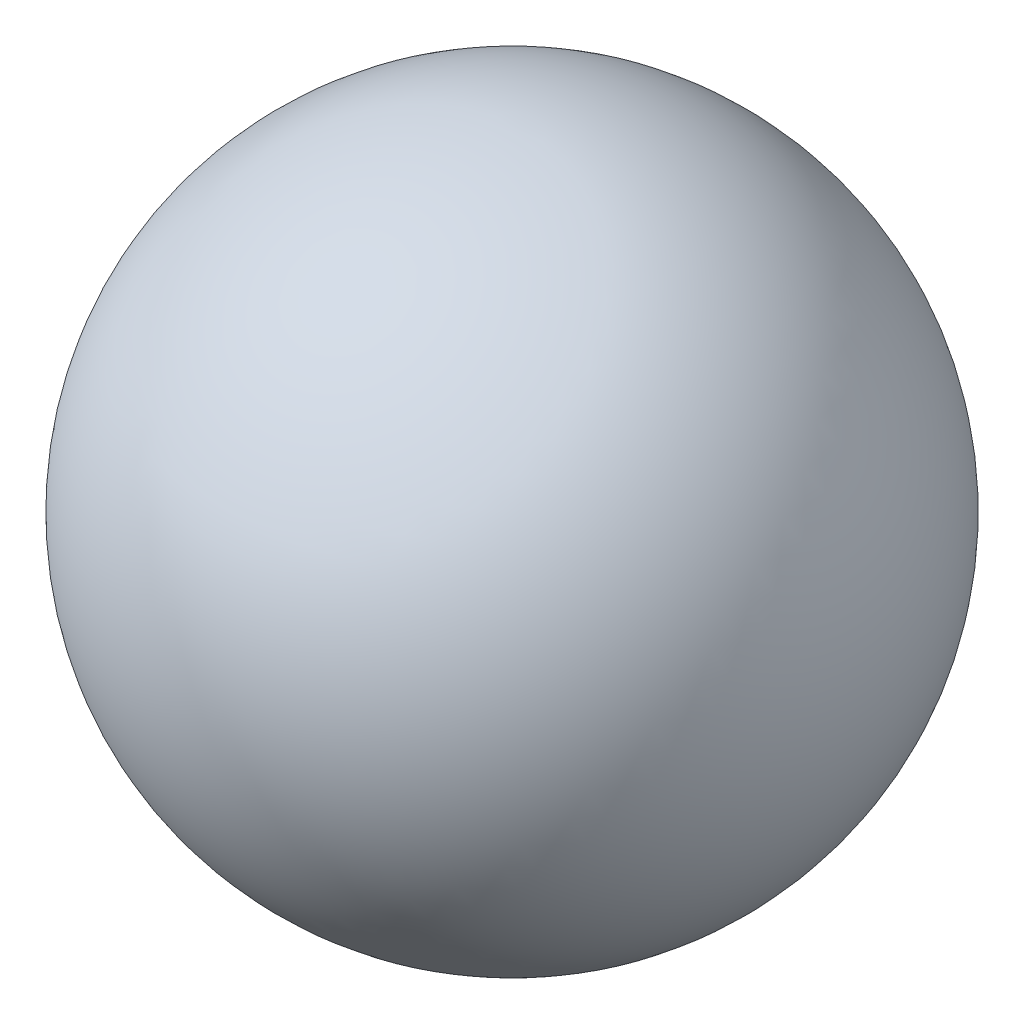
from build123d import *


with BuildPart() as part:
    # Sketch1 → Revolve1 (revolve)
    with BuildSketch(Plane.XY):
        with BuildLine():
            Line((0, 3.5), (0, -3.5))
            ThreePointArc((0, -3.5), (3.5, 0), (0, 3.5))
        make_face()
    revolve(axis=Axis((0, 3.5, 0), (0, -1, 0)))


solid = part.part
